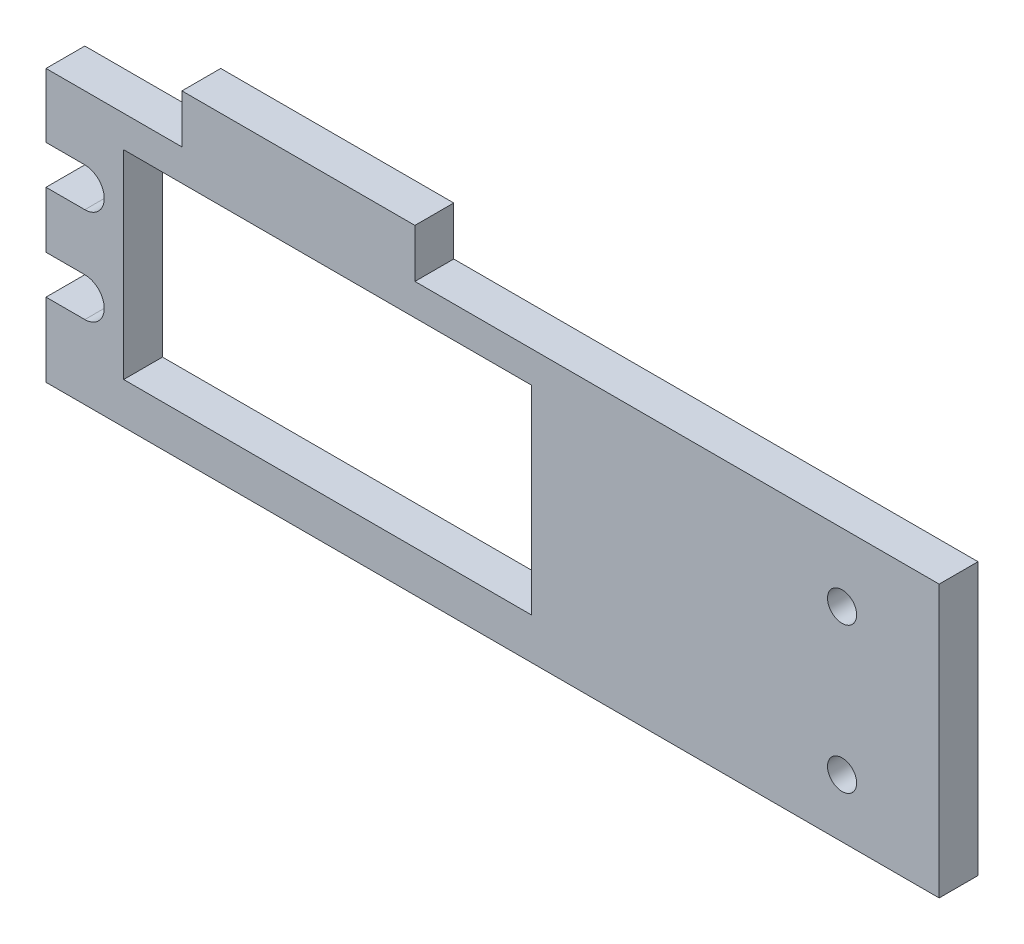
from build123d import *

# Parameters (mm, degrees)
SKETCH1_R           = 1.5
SKETCH1_W           = 42
SKETCH1_H           = 20.5
BOSS_EXTRUDE1_DEPTH = 4


with BuildPart() as part:
    # Sketch1 → Boss-Extrude1 (new body)
    with BuildSketch(Plane.XY):
        with BuildLine():
            Line((0, 0), (0, 28))
            Line((0, 28), (-54, 28))
            Line((-54, 28), (-54, 33))
            Line((-54, 33), (-78, 33))
            Line((-78, 33), (-78, 28))
            Line((-78, 28), (-92, 28))
            Line((-92, 28), (-92, 21.4))
            Line((-92, 21.4), (-88, 21.4))
            ThreePointArc((-88, 21.4), (-86, 19.4), (-88, 17.4))
            Line((-88, 17.4), (-92, 17.4))
            Line((-92, 17.4), (-92, 11.6))
            Line((-92, 11.6), (-88, 11.6))
            ThreePointArc((-88, 11.6), (-86, 9.6), (-88, 7.6))
            Line((-88, 7.6), (-92, 7.6))
            Line((-92, 7.6), (-92, 0))
            Line((-92, 0), (0, 0))
        make_face()
        with Locations((-10, 21)):
            Circle(SKETCH1_R, mode=Mode.SUBTRACT)
        with Locations((-10, 6)):
            Circle(SKETCH1_R, mode=Mode.SUBTRACT)
        with Locations((-63, 14.5)):
            Rectangle(SKETCH1_W, SKETCH1_H, mode=Mode.SUBTRACT)
    extrude(amount=BOSS_EXTRUDE1_DEPTH)


solid = part.part
